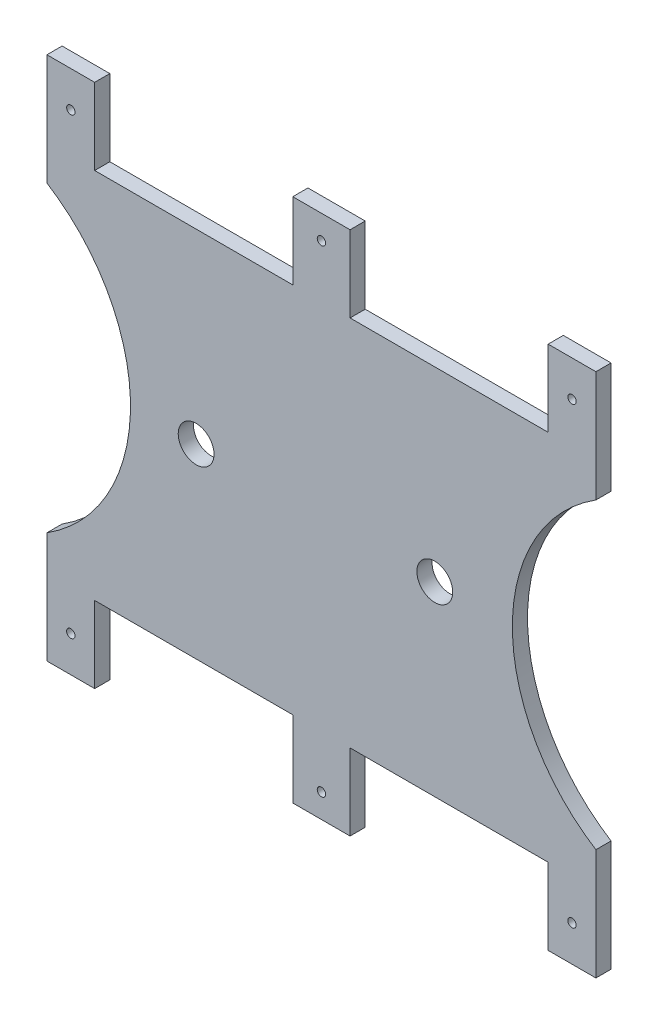
from build123d import *

# Parameters (mm, degrees)
SKETCH1_R           = 7.5
SKETCH1_R_2         = 1.7525
BOSS_EXTRUDE1_DEPTH = 6.35


with BuildPart() as part:
    # Sketch1 → Boss-Extrude1 (new body)
    with BuildSketch(Plane.XY):
        with BuildLine():
            Line((100, 110), (80, 110))
            Line((80, 110), (80, 78))
            Line((80, 78), (-3, 78))
            Line((-3, 78), (-3, 110))
            Line((-3, 110), (-27, 110))
            Line((-27, 110), (-27, 78))
            Line((-27, 78), (-110, 78))
            Line((-110, 78), (-110, 110))
            Line((-110, 110), (-130, 110))
            Line((-130, 110), (-130, 63.442887702))
            ThreePointArc((-130, 63.442887702), (-95, 0), (-130, -63.442887702))
            Line((-130, -63.442887702), (-130, -110))
            Line((-130, -110), (-110, -110))
            Line((-110, -110), (-110, -78))
            Line((-110, -78), (-27, -78))
            Line((-27, -78), (-27, -110))
            Line((-27, -110), (-3, -110))
            Line((-3, -110), (-3, -78))
            Line((-3, -78), (80, -78))
            Line((80, -78), (80, -110))
            Line((80, -110), (100, -110))
            Line((100, -110), (100, -63.442887702))
            ThreePointArc((100, -63.442887702), (65, 0), (100, 63.442887702))
            Line((100, 63.442887702), (100, 110))
        make_face()
        with Locations((32.5, 0)):
            Circle(SKETCH1_R, mode=Mode.SUBTRACT)
        with Locations(Location((-67.5, 0, 0), (0, 0, 180))):
            Circle(SKETCH1_R, mode=Mode.SUBTRACT)
        with Locations((-120, 95)):
            Circle(SKETCH1_R_2, mode=Mode.SUBTRACT)
        with Locations(Location((90, 95, 0), (0, 0, 180))):
            Circle(SKETCH1_R_2, mode=Mode.SUBTRACT)
        with Locations((-15, 100)):
            Circle(SKETCH1_R_2, mode=Mode.SUBTRACT)
        with Locations(Location((-15, -100, 0), (0, 0, 180))):
            Circle(SKETCH1_R_2, mode=Mode.SUBTRACT)
        with Locations((90, -95)):
            Circle(SKETCH1_R_2, mode=Mode.SUBTRACT)
        with Locations(Location((-120, -95, 0), (0, 0, 180))):
            Circle(SKETCH1_R_2, mode=Mode.SUBTRACT)
    extrude(amount=BOSS_EXTRUDE1_DEPTH)


solid = part.part
